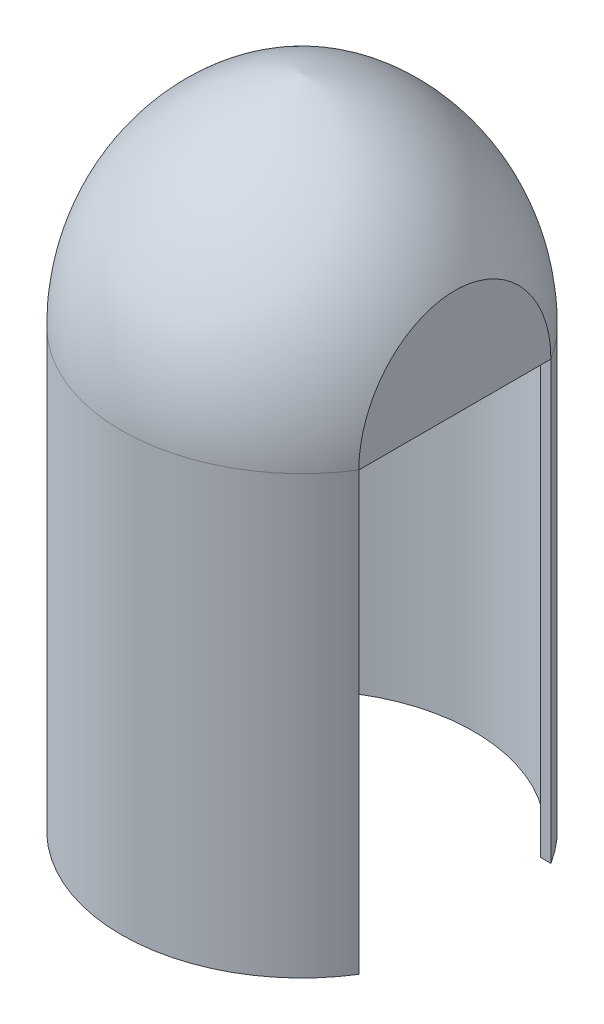
from build123d import *

# Parameters (mm, degrees)
SKETCH2_OUTSIDE_W   = 164.146
SKETCH2_OUTSIDE_H   = 164.146
SKETCH2_OUTSIDE_W_2 = 105
SKETCH2_OUTSIDE_H_2 = 145.767420334
CUT_EXTRUDE2_DEPTH  = 116.381974501
BOSS_EXTRUDE2_REACH = 112.568
SKETCH3_W           = 3.579145551
SKETCH3_H           = 65.962110336
BOSS_EXTRUDE4_DEPTH = 150


with BuildPart() as part:
    # Sketch1 → Revolve1 (revolve)
    with BuildSketch(Plane.XY):
        with BuildLine():
            Line((62, 0), (59, 0))
            ThreePointArc((59, 0), (42.363721251, 46.52102369), (0, 71.943189953))
            Line((0, 71.943189953), (0, 75))
            ThreePointArc((0, 75), (44.493217858, 48.65439343), (62, 0))
        make_face()
    revolve(axis=Axis((0, 75, 0), (0, -1, 0)))

    # Sketch2 outside → Cut-Extrude2 (cut, through all)
    with BuildSketch(Plane(origin=(0, 0, 0), x_dir=(-1, 0, 0), z_dir=(0, -1, 0))):
        Rectangle(SKETCH2_OUTSIDE_W, SKETCH2_OUTSIDE_H)
        Rectangle(SKETCH2_OUTSIDE_W_2, SKETCH2_OUTSIDE_H_2, mode=Mode.SUBTRACT)
    extrude(amount=-CUT_EXTRUDE2_DEPTH, mode=Mode.SUBTRACT)

    # Sketch3 → Boss-Extrude2 (add, up to next)
    with BuildSketch(Plane.XZ, mode=Mode.PRIVATE) as boss_extrude2_sk1:
        with Locations((-50.710427225, 0)):
            Rectangle(SKETCH3_W, SKETCH3_H)
    boss_extrude2_tool1 = extrude(boss_extrude2_sk1.sketch, amount=-BOSS_EXTRUDE2_REACH, mode=Mode.PRIVATE) - part.part
    # Sketch3 → Boss-Extrude2 (add, up to next)
    with BuildSketch(Plane.XZ, mode=Mode.PRIVATE) as boss_extrude2_sk2:
        with Locations((50.710427225, 0)):
            Rectangle(SKETCH3_W, SKETCH3_H)
    boss_extrude2_tool2 = extrude(boss_extrude2_sk2.sketch, amount=-BOSS_EXTRUDE2_REACH, mode=Mode.PRIVATE) - part.part
    add(boss_extrude2_tool1.solids().sort_by_distance((-50.710427, 0, 0))[0])
    add(boss_extrude2_tool2.solids().sort_by_distance((50.710427, 0, 0))[0])

    # Sketch4 → Boss-Extrude4 (add)
    with BuildSketch(Plane(origin=(0, 0, 0), x_dir=(-1, 0, 0), z_dir=(0, -1, 0))):
        with BuildLine():
            Line((52.500662853, -32.98), (48.921565797, -32.98))
            ThreePointArc((48.921565797, -32.98), (0, -59), (-48.921565797, -32.98))
            Line((-48.921565797, -32.98), (-52.500662853, -32.98))
            ThreePointArc((-52.500662853, -32.98), (0, -62), (52.500662853, -32.98))
        make_face()
        with BuildLine():
            Line((-48.921565797, 32.98), (-52.500662853, 32.98))
            ThreePointArc((-52.500662853, 32.98), (0, 62), (52.500662853, 32.98))
            Line((52.500662853, 32.98), (48.921565797, 32.98))
            ThreePointArc((48.921565797, 32.98), (0, 59), (-48.921565797, 32.98))
        make_face()
    extrude(amount=BOSS_EXTRUDE4_DEPTH)


solid = part.part
